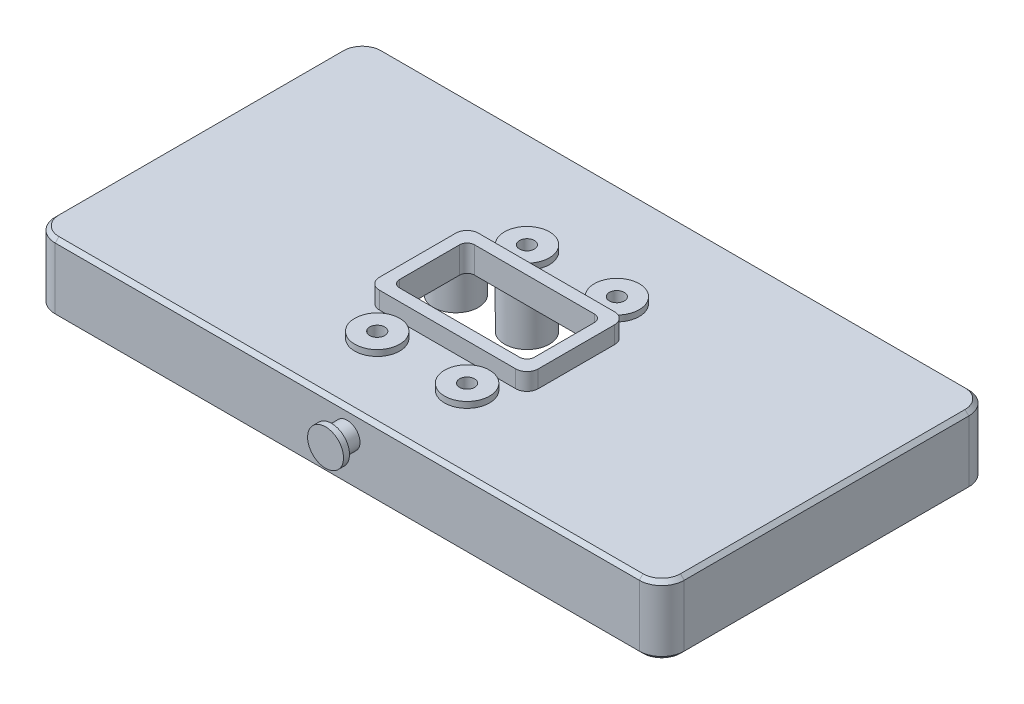
from build123d import *

# Parameters (mm, degrees)
BOSS_EXTRUDE1_START  = 50
BOSS_EXTRUDE1_DEPTH  = 9.2
CHAMFER1_SIZE        = 0.5
CHAMFER2_SIZE        = 0.5
BOSS_EXTRUDE2_START  = 49
BOSS_EXTRUDE2_DEPTH  = 9
BOSS_EXTRUDE3_START  = 50
SKETCH3_R            = 3
BOSS_EXTRUDE3_DEPTH  = 8.01
BOSS_EXTRUDE4_START  = 49
SKETCH4_R            = 1
BOSS_EXTRUDE4_DEPTH  = 9.4
BOSS_EXTRUDE5_START  = 50
SKETCH5_R            = 3
BOSS_EXTRUDE5_DEPTH  = 8.01
BOSS_EXTRUDE6_START  = 49
SKETCH6_R            = 1
BOSS_EXTRUDE6_DEPTH  = 9.4
BOSS_EXTRUDE7_START  = 50
SKETCH7_R            = 3
BOSS_EXTRUDE7_DEPTH  = 8.01
BOSS_EXTRUDE8_START  = 49
SKETCH8_R            = 1
BOSS_EXTRUDE8_DEPTH  = 9.4
BOSS_EXTRUDE9_START  = 50
SKETCH9_R            = 3
BOSS_EXTRUDE9_DEPTH  = 8.01
BOSS_EXTRUDE10_START = 49
SKETCH10_R           = 1
BOSS_EXTRUDE10_DEPTH = 9.4
BOSS_EXTRUDE11_START = 50
SKETCH11_R           = 3
BOSS_EXTRUDE11_DEPTH = 10
BOSS_EXTRUDE12_START = 51.5
SKETCH12_R           = 1
BOSS_EXTRUDE12_DEPTH = 9.5
BOSS_EXTRUDE13_START = 50
SKETCH13_R           = 3
BOSS_EXTRUDE13_DEPTH = 10
BOSS_EXTRUDE14_START = 51.5
SKETCH14_R           = 1
BOSS_EXTRUDE14_DEPTH = 9.5
BOSS_EXTRUDE15_START = 50
SKETCH15_R           = 3
BOSS_EXTRUDE15_DEPTH = 10
BOSS_EXTRUDE16_START = 51.5
SKETCH16_R           = 1
BOSS_EXTRUDE16_DEPTH = 9.5
BOSS_EXTRUDE17_START = 50
SKETCH17_R           = 3
BOSS_EXTRUDE17_DEPTH = 10
BOSS_EXTRUDE18_START = 51.5
SKETCH18_R           = 1
BOSS_EXTRUDE18_DEPTH = 9.5
BOSS_EXTRUDE19_START = 78.39
SKETCH19_R           = 1.7
BOSS_EXTRUDE19_DEPTH = 3.71
BOSS_EXTRUDE20_START = 82.1
SKETCH20_R           = 2.4
BOSS_EXTRUDE20_DEPTH = 0.8
BOSS_EXTRUDE21_START = 50
BOSS_EXTRUDE21_DEPTH = 1.2
BOSS_EXTRUDE22_START = 57.99
BOSS_EXTRUDE22_DEPTH = 3.51
BOSS_EXTRUDE23_START = 49
BOSS_EXTRUDE23_DEPTH = 13


with BuildPart() as part:
    # Sketch1 → Boss-Extrude1 (new body)
    with BuildSketch(Plane(origin=(0, 0, 0), x_dir=(1, 0, 0), z_dir=(0, 1, 0)).offset(BOSS_EXTRUDE1_START)):
        with BuildLine():
            Line((-39, -36), (39, -36))
            ThreePointArc((39, -36), (41.121320344, -36.878679656), (42, -39))
            Line((42, -39), (42, -77))
            ThreePointArc((42, -77), (41.121320344, -79.121320344), (39, -80))
            Line((39, -80), (-39, -80))
            ThreePointArc((-39, -80), (-41.121320344, -79.121320344), (-42, -77))
            Line((-42, -77), (-42, -39))
            ThreePointArc((-42, -39), (-41.121320344, -36.878679656), (-39, -36))
        make_face()
    extrude(amount=BOSS_EXTRUDE1_DEPTH)

    # Chamfer1
    chamfer1_edges = [part.edges().sort_by_distance(p)[0] for p in [
        (0, 50, 36),
        (-41.121320344, 50, 36.878679656),
        (41.121320344, 50, 36.878679656),
        (-42, 50, 58),
        (42, 50, 58),
        (-41.121320344, 50, 79.121320344),
        (41.121320344, 50, 79.121320344),
        (0, 50, 80),
    ]]
    chamfer(chamfer1_edges, length=CHAMFER1_SIZE)

    # Chamfer2
    chamfer2_edges = [part.edges().sort_by_distance(p)[0] for p in [
        (0, 59.2, 36),
        (-41.121320344, 59.2, 36.878679656),
        (41.121320344, 59.2, 36.878679656),
        (-42, 59.2, 58),
        (42, 59.2, 58),
        (-41.121320344, 59.2, 79.121320344),
        (41.121320344, 59.2, 79.121320344),
        (0, 59.2, 80),
    ]]
    chamfer(chamfer2_edges, length=CHAMFER2_SIZE)


with BuildPart() as body_2:
    # Sketch2 → Boss-Extrude2 (new body)
    with BuildSketch(Plane(origin=(0, 0, 0), x_dir=(1, 0, 0), z_dir=(0, 1, 0)).offset(BOSS_EXTRUDE2_START)):
        with BuildLine():
            Line((-39, -37.6), (39, -37.6))
            ThreePointArc((39, -37.6), (39.989949494, -38.010050506), (40.4, -39))
            Line((40.4, -39), (40.4, -77))
            ThreePointArc((40.4, -77), (39.989949494, -77.989949494), (39, -78.4))
            Line((39, -78.4), (-39, -78.4))
            ThreePointArc((-39, -78.4), (-39.989949494, -77.989949494), (-40.4, -77))
            Line((-40.4, -77), (-40.4, -39))
            ThreePointArc((-40.4, -39), (-39.989949494, -38.010050506), (-39, -37.6))
        make_face()
    extrude(amount=BOSS_EXTRUDE2_DEPTH)


with BuildPart() as part_1:
    add(part.part)

    # Combine1: cut body 2
    add(body_2.part, mode=Mode.SUBTRACT)

    # Sketch3 → Boss-Extrude3 (add)
    with BuildSketch(Plane(origin=(0, 0, 0), x_dir=(1, 0, 0), z_dir=(0, 1, 0)).offset(BOSS_EXTRUDE3_START)):
        with Locations((-15, -50.5)):
            Circle(SKETCH3_R)
    extrude(amount=BOSS_EXTRUDE3_DEPTH)


with BuildPart() as body_2_2:
    # Sketch4 → Boss-Extrude4 (new body)
    with BuildSketch(Plane(origin=(0, 0, 0), x_dir=(1, 0, 0), z_dir=(0, 1, 0)).offset(BOSS_EXTRUDE4_START)):
        with Locations((-15, -50.5)):
            Circle(SKETCH4_R)
    extrude(amount=BOSS_EXTRUDE4_DEPTH)


with BuildPart() as part_2:
    add(part_1.part)

    # Combine2: cut body 2 2
    add(body_2_2.part, mode=Mode.SUBTRACT)

    # Sketch5 → Boss-Extrude5 (add)
    with BuildSketch(Plane(origin=(0, 0, 0), x_dir=(1, 0, 0), z_dir=(0, 1, 0)).offset(BOSS_EXTRUDE5_START)):
        with Locations((-15, -69.5)):
            Circle(SKETCH5_R)
    extrude(amount=BOSS_EXTRUDE5_DEPTH)


with BuildPart() as body_2_3:
    # Sketch6 → Boss-Extrude6 (new body)
    with BuildSketch(Plane(origin=(0, 0, 0), x_dir=(1, 0, 0), z_dir=(0, 1, 0)).offset(BOSS_EXTRUDE6_START)):
        with Locations((-15, -69.5)):
            Circle(SKETCH6_R)
    extrude(amount=BOSS_EXTRUDE6_DEPTH)


with BuildPart() as part_3:
    add(part_2.part)

    # Combine3: cut body 2 3
    add(body_2_3.part, mode=Mode.SUBTRACT)

    # Sketch7 → Boss-Extrude7 (add)
    with BuildSketch(Plane(origin=(0, 0, 0), x_dir=(1, 0, 0), z_dir=(0, 1, 0)).offset(BOSS_EXTRUDE7_START)):
        with Locations((15, -50.5)):
            Circle(SKETCH7_R)
    extrude(amount=BOSS_EXTRUDE7_DEPTH)


with BuildPart() as body_2_4:
    # Sketch8 → Boss-Extrude8 (new body)
    with BuildSketch(Plane(origin=(0, 0, 0), x_dir=(1, 0, 0), z_dir=(0, 1, 0)).offset(BOSS_EXTRUDE8_START)):
        with Locations((15, -50.5)):
            Circle(SKETCH8_R)
    extrude(amount=BOSS_EXTRUDE8_DEPTH)


with BuildPart() as part_4:
    add(part_3.part)

    # Combine4: cut body 2 4
    add(body_2_4.part, mode=Mode.SUBTRACT)

    # Sketch9 → Boss-Extrude9 (add)
    with BuildSketch(Plane(origin=(0, 0, 0), x_dir=(1, 0, 0), z_dir=(0, 1, 0)).offset(BOSS_EXTRUDE9_START)):
        with Locations((15, -69.5)):
            Circle(SKETCH9_R)
    extrude(amount=BOSS_EXTRUDE9_DEPTH)


with BuildPart() as body_2_5:
    # Sketch10 → Boss-Extrude10 (new body)
    with BuildSketch(Plane(origin=(0, 0, 0), x_dir=(1, 0, 0), z_dir=(0, 1, 0)).offset(BOSS_EXTRUDE10_START)):
        with Locations((15, -69.5)):
            Circle(SKETCH10_R)
    extrude(amount=BOSS_EXTRUDE10_DEPTH)


with BuildPart() as part_5:
    add(part_4.part)

    # Combine5: cut body 2 5
    add(body_2_5.part, mode=Mode.SUBTRACT)

    # Sketch11 → Boss-Extrude11 (add)
    with BuildSketch(Plane(origin=(0, 0, 0), x_dir=(1, 0, 0), z_dir=(0, 1, 0)).offset(BOSS_EXTRUDE11_START)):
        with Locations((-6, -50)):
            Circle(SKETCH11_R)
    extrude(amount=BOSS_EXTRUDE11_DEPTH)


with BuildPart() as body_2_6:
    # Sketch12 → Boss-Extrude12 (new body)
    with BuildSketch(Plane(origin=(0, 0, 0), x_dir=(1, 0, 0), z_dir=(0, 1, 0)).offset(BOSS_EXTRUDE12_START)):
        with Locations((-6, -50)):
            Circle(SKETCH12_R)
    extrude(amount=BOSS_EXTRUDE12_DEPTH)


with BuildPart() as part_6:
    add(part_5.part)

    # Combine6: cut body 2 6
    add(body_2_6.part, mode=Mode.SUBTRACT)

    # Sketch13 → Boss-Extrude13 (add)
    with BuildSketch(Plane(origin=(0, 0, 0), x_dir=(1, 0, 0), z_dir=(0, 1, 0)).offset(BOSS_EXTRUDE13_START)):
        with Locations((-6, -70)):
            Circle(SKETCH13_R)
    extrude(amount=BOSS_EXTRUDE13_DEPTH)


with BuildPart() as body_2_7:
    # Sketch14 → Boss-Extrude14 (new body)
    with BuildSketch(Plane(origin=(0, 0, 0), x_dir=(1, 0, 0), z_dir=(0, 1, 0)).offset(BOSS_EXTRUDE14_START)):
        with Locations((-6, -70)):
            Circle(SKETCH14_R)
    extrude(amount=BOSS_EXTRUDE14_DEPTH)


with BuildPart() as part_7:
    add(part_6.part)

    # Combine7: cut body 2 7
    add(body_2_7.part, mode=Mode.SUBTRACT)

    # Sketch15 → Boss-Extrude15 (add)
    with BuildSketch(Plane(origin=(0, 0, 0), x_dir=(1, 0, 0), z_dir=(0, 1, 0)).offset(BOSS_EXTRUDE15_START)):
        with Locations((6, -50)):
            Circle(SKETCH15_R)
    extrude(amount=BOSS_EXTRUDE15_DEPTH)


with BuildPart() as body_2_8:
    # Sketch16 → Boss-Extrude16 (new body)
    with BuildSketch(Plane(origin=(0, 0, 0), x_dir=(1, 0, 0), z_dir=(0, 1, 0)).offset(BOSS_EXTRUDE16_START)):
        with Locations((6, -50)):
            Circle(SKETCH16_R)
    extrude(amount=BOSS_EXTRUDE16_DEPTH)


with BuildPart() as part_8:
    add(part_7.part)

    # Combine8: cut body 2 8
    add(body_2_8.part, mode=Mode.SUBTRACT)

    # Sketch17 → Boss-Extrude17 (add)
    with BuildSketch(Plane(origin=(0, 0, 0), x_dir=(1, 0, 0), z_dir=(0, 1, 0)).offset(BOSS_EXTRUDE17_START)):
        with Locations((6, -70)):
            Circle(SKETCH17_R)
    extrude(amount=BOSS_EXTRUDE17_DEPTH)


with BuildPart() as body_2_9:
    # Sketch18 → Boss-Extrude18 (new body)
    with BuildSketch(Plane(origin=(0, 0, 0), x_dir=(1, 0, 0), z_dir=(0, 1, 0)).offset(BOSS_EXTRUDE18_START)):
        with Locations((6, -70)):
            Circle(SKETCH18_R)
    extrude(amount=BOSS_EXTRUDE18_DEPTH)


with BuildPart() as part_9:
    add(part_8.part)

    # Combine9: cut body 2 9
    add(body_2_9.part, mode=Mode.SUBTRACT)

    # Sketch19 → Boss-Extrude19 (add)
    with BuildSketch(Plane.XY.offset(BOSS_EXTRUDE19_START)):
        with Locations((0, 56)):
            Circle(SKETCH19_R)
    extrude(amount=BOSS_EXTRUDE19_DEPTH)

    # Sketch20 → Boss-Extrude20 (add)
    with BuildSketch(Plane.XY.offset(BOSS_EXTRUDE20_START)):
        with Locations((0, 56)):
            Circle(SKETCH20_R)
    extrude(amount=BOSS_EXTRUDE20_DEPTH)

    # Sketch21 → Boss-Extrude21 (add)
    with BuildSketch(Plane(origin=(0, 0, 0), x_dir=(1, 0, 0), z_dir=(0, 1, 0)).offset(BOSS_EXTRUDE21_START)):
        with BuildLine():
            Line((-38.99, -37.59), (38.99, -37.59))
            ThreePointArc((38.99, -37.59), (39.979949494, -38.000050506), (40.39, -38.99))
            Line((40.39, -38.99), (40.39, -77.01))
            ThreePointArc((40.39, -77.01), (39.979949494, -77.999949494), (38.99, -78.41))
            Line((38.99, -78.41), (-38.99, -78.41))
            ThreePointArc((-38.99, -78.41), (-39.979949494, -77.999949494), (-40.39, -77.01))
            Line((-40.39, -77.01), (-40.39, -38.99))
            ThreePointArc((-40.39, -38.99), (-39.979949494, -38.000050506), (-38.99, -37.59))
        make_face()
        with BuildLine():
            Line((-33.6, -39.6), (33.6, -39.6))
            ThreePointArc((33.6, -39.6), (34.307106781, -39.892893219), (34.6, -40.6))
            Line((34.6, -40.6), (34.6, -71.6))
            ThreePointArc((34.6, -71.6), (34.307106781, -72.307106781), (33.6, -72.6))
            Line((33.6, -72.6), (-33.6, -72.6))
            ThreePointArc((-33.6, -72.6), (-34.307106781, -72.307106781), (-34.6, -71.6))
            Line((-34.6, -71.6), (-34.6, -40.6))
            ThreePointArc((-34.6, -40.6), (-34.307106781, -39.892893219), (-33.6, -39.6))
        make_face(mode=Mode.SUBTRACT)
    extrude(amount=BOSS_EXTRUDE21_DEPTH)

    # Sketch22 → Boss-Extrude22 (add)
    with BuildSketch(Plane(origin=(0, 0, 0), x_dir=(1, 0, 0), z_dir=(0, 1, 0)).offset(BOSS_EXTRUDE22_START)):
        with BuildLine():
            Line((-9.1, -53.4), (9.1, -53.4))
            ThreePointArc((9.1, -53.4), (10.160660172, -53.839339828), (10.6, -54.9))
            Line((10.6, -54.9), (10.6, -65.1))
            ThreePointArc((10.6, -65.1), (10.160660172, -66.160660172), (9.1, -66.6))
            Line((9.1, -66.6), (-9.1, -66.6))
            ThreePointArc((-9.1, -66.6), (-10.160660172, -66.160660172), (-10.6, -65.1))
            Line((-10.6, -65.1), (-10.6, -54.9))
            ThreePointArc((-10.6, -54.9), (-10.160660172, -53.839339828), (-9.1, -53.4))
        make_face()
    extrude(amount=BOSS_EXTRUDE22_DEPTH)


with BuildPart() as body_2_10:
    # Sketch23 → Boss-Extrude23 (new body)
    with BuildSketch(Plane(origin=(0, 0, 0), x_dir=(1, 0, 0), z_dir=(0, 1, 0)).offset(BOSS_EXTRUDE23_START)):
        with BuildLine():
            Line((-8, -55), (8, -55))
            ThreePointArc((8, -55), (8.707106781, -55.292893219), (9, -56))
            Line((9, -56), (9, -64))
            ThreePointArc((9, -64), (8.707106781, -64.707106781), (8, -65))
            Line((8, -65), (-8, -65))
            ThreePointArc((-8, -65), (-8.707106781, -64.707106781), (-9, -64))
            Line((-9, -64), (-9, -56))
            ThreePointArc((-9, -56), (-8.707106781, -55.292893219), (-8, -55))
        make_face()
    extrude(amount=BOSS_EXTRUDE23_DEPTH)


with BuildPart() as part_10:
    add(part_9.part)

    # Combine10: cut body 2 10
    add(body_2_10.part, mode=Mode.SUBTRACT)


solid = part_10.part
